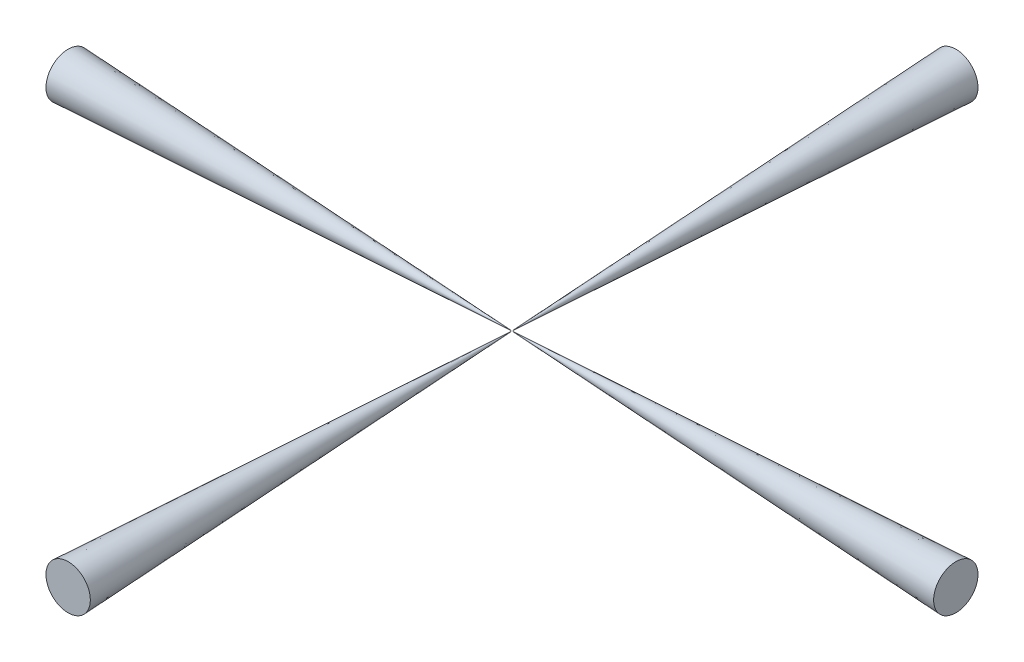
from build123d import *

# Parameters (mm, degrees)
PATTERN_CIRCULAR_3_COUNT = 2
PATTERN_CIRCULAR_3_ANGLE = 90


with BuildPart() as part:
    # 草图2 → 旋转5 (revolve)
    with BuildSketch(Plane(origin=(0, 0, 0), x_dir=(1, 0, 0), z_dir=(0, 1, 0))):
        Polygon((0, 0), (0, 0.0125), (200, 10), (200, 0), align=None)
    revolve_5 = revolve(axis=Axis((200, 0, 0), (-1, 0, 0)))

    # 镜向1: 旋转5 across Right Plane
    add(revolve_5.mirror(Plane(origin=(0, 0, 0), x_dir=(0, 0, -1), z_dir=(1, 0, 0))))


with BuildPart() as pattern_circular_3_1:
    # 阵列(圆周)3: pattern copy
    add(part.part.rotate(Axis((0, 1.112434979, 0), (0, -1, 0)), 1 * PATTERN_CIRCULAR_3_ANGLE / (PATTERN_CIRCULAR_3_COUNT - 1)))


solid = Compound([part.part, pattern_circular_3_1.part])
